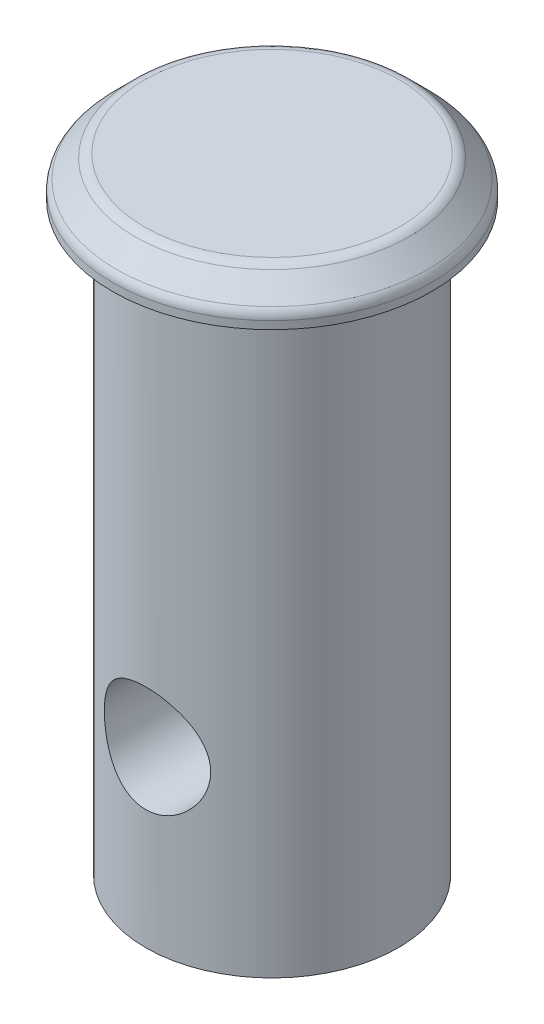
from build123d import *

# Parameters (mm, degrees)
SKETCH1_R               = 4.75
BOSS_EXTRUDE1_DEPTH     = 22
SKETCH2_R               = 6
BOSS_EXTRUDE2_DEPTH     = 1.5
CHAMFER1_SIZE           = 1
FILLET1_R               = 0.5
CUT_EXTRUDE1_DEPTH      = 25.984995545
CUT_EXTRUDE1_DEPTH_BACK = 25.984995545
SKETCH3_R               = 2


with BuildPart() as part:
    # Sketch1 → Boss-Extrude1 (new body)
    with BuildSketch(Plane(origin=(0, 0, 0), x_dir=(1, 0, 0), z_dir=(0, 1, 0))):
        with Locations(Location((0, 0, 0), (0, 0, 270))):
            Circle(SKETCH1_R)
    extrude(amount=BOSS_EXTRUDE1_DEPTH)

    # Sketch2 → Boss-Extrude2 (add)
    with BuildSketch(Plane(origin=(0, 22, 0), x_dir=(1, 0, 0), z_dir=(0, 1, 0))):
        with Locations(Location((0, 0, 0), (0, 0, 270))):
            Circle(SKETCH2_R)
    extrude(amount=BOSS_EXTRUDE2_DEPTH)

    # Chamfer1
    chamfer1_edges = [part.edges().sort_by_distance(p)[0] for p in [
        (0, 23.5, -6),
    ]]
    chamfer(chamfer1_edges, length=CHAMFER1_SIZE)

    # Fillet1
    fillet1_edges = [part.edges().sort_by_distance(p)[0] for p in [
        (0, 23.5, -5),
        (0, 22.5, -6),
    ]]
    fillet(fillet1_edges, radius=FILLET1_R)

    # Sketch3 → Cut-Extrude1 (cut, two sides: drawn at the far end of the back side and taken through both)
    with BuildSketch(Plane.XY.offset(-CUT_EXTRUDE1_DEPTH_BACK)):
        with Locations(Location((0, 6.5, 0), (0, 0, 90))):
            Circle(SKETCH3_R)
    extrude(amount=CUT_EXTRUDE1_DEPTH + CUT_EXTRUDE1_DEPTH_BACK, mode=Mode.SUBTRACT)


solid = part.part
